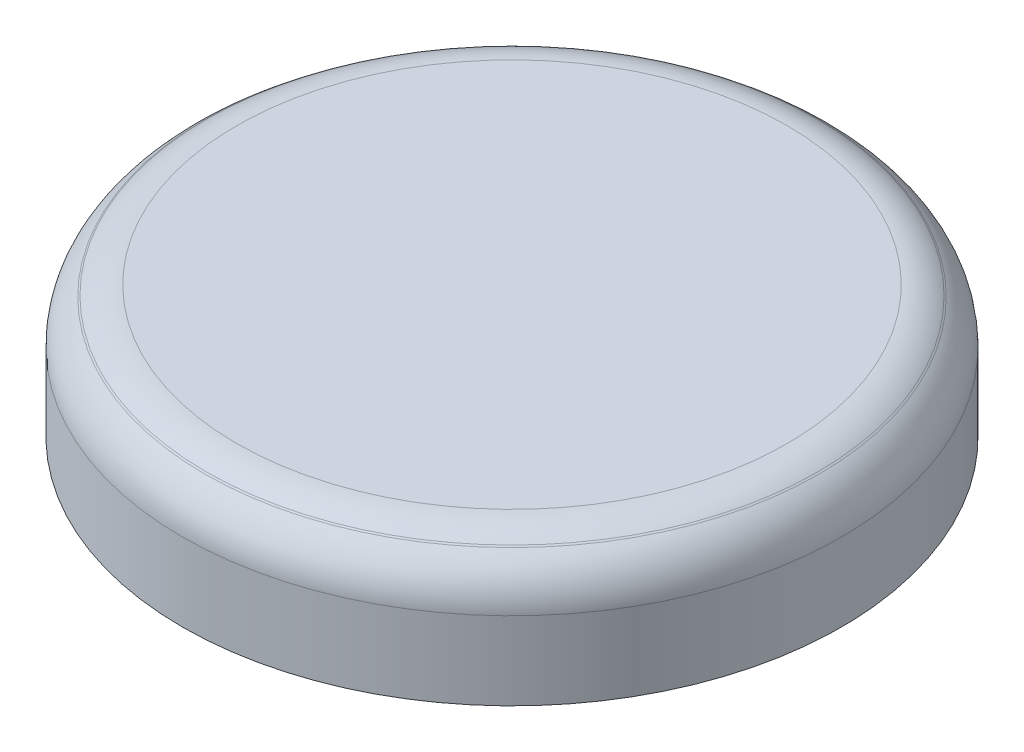
from build123d import *

# Parameters (mm, degrees)
SKETCH1_R           = 12.5
SKETCH1_R_2         = 4.25
BOSS_EXTRUDE1_DEPTH = 5
BOSS_EXTRUDE2_START = -1
SKETCH2_R           = 4.25
BOSS_EXTRUDE2_DEPTH = 1
SKETCH3_R           = 1.25
CUT_EXTRUDE1_DEPTH  = 3
CHAMFER1_SIZE       = 1
CHAMFER1_SIZE2      = 1.428148007
FILLET1_R           = 2


with BuildPart() as part:
    # Sketch1 → Boss-Extrude1 (new body)
    with BuildSketch(Plane(origin=(0, 0, 0), x_dir=(1, 0, 0), z_dir=(0, 1, 0))):
        with Locations(Location((0, 0, 0), (0, 0, 270))):
            Circle(SKETCH1_R)
        with Locations(Location((0, 0, 0), (0, 0, 270))):
            Circle(SKETCH1_R_2, mode=Mode.SUBTRACT)
    extrude(amount=BOSS_EXTRUDE1_DEPTH)

    # Sketch2 → Boss-Extrude2 (add)
    with BuildSketch(Plane(origin=(0, 5, 0), x_dir=(1, 0, 0), z_dir=(0, 1, 0)).offset(BOSS_EXTRUDE2_START)):
        with Locations(Location((0, 0, 0), (0, 0, 270))):
            Circle(SKETCH2_R)
    extrude(amount=BOSS_EXTRUDE2_DEPTH)

    # Sketch3 → Cut-Extrude1 (cut)
    with BuildSketch(Plane(origin=(0, 0, 0), x_dir=(-1, 0, 0), z_dir=(0, -1, 0))):
        with Locations(Location((0, -9, 0), (0, 0, 90))):
            Circle(SKETCH3_R)
        with Locations(Location((-9, 0, 0), (0, 0, 90))):
            Circle(SKETCH3_R)
        with Locations(Location((0, 9, 0), (0, 0, 90))):
            Circle(SKETCH3_R)
        with Locations(Location((9, 0, 0), (0, 0, 90))):
            Circle(SKETCH3_R)
    extrude(amount=-CUT_EXTRUDE1_DEPTH, mode=Mode.SUBTRACT)

    # Chamfer1
    chamfer1_edges = [part.edges().sort_by_distance(p)[0] for p in [
        (0, 5, -12.5),
    ]]
    chamfer1_side = [part.faces().sort_by_distance(p)[0] for p in [
        (0, 2.5, -12.5),
    ]]
    chamfer(chamfer1_edges, length=CHAMFER1_SIZE, length2=CHAMFER1_SIZE2, reference=chamfer1_side[0])

    # Fillet1
    fillet1_edges = [part.edges().sort_by_distance(p)[0] for p in [
        (0, 5, -11.071851993),
        (0, 4, -12.5),
    ]]
    fillet(fillet1_edges, radius=FILLET1_R)


solid = part.part
